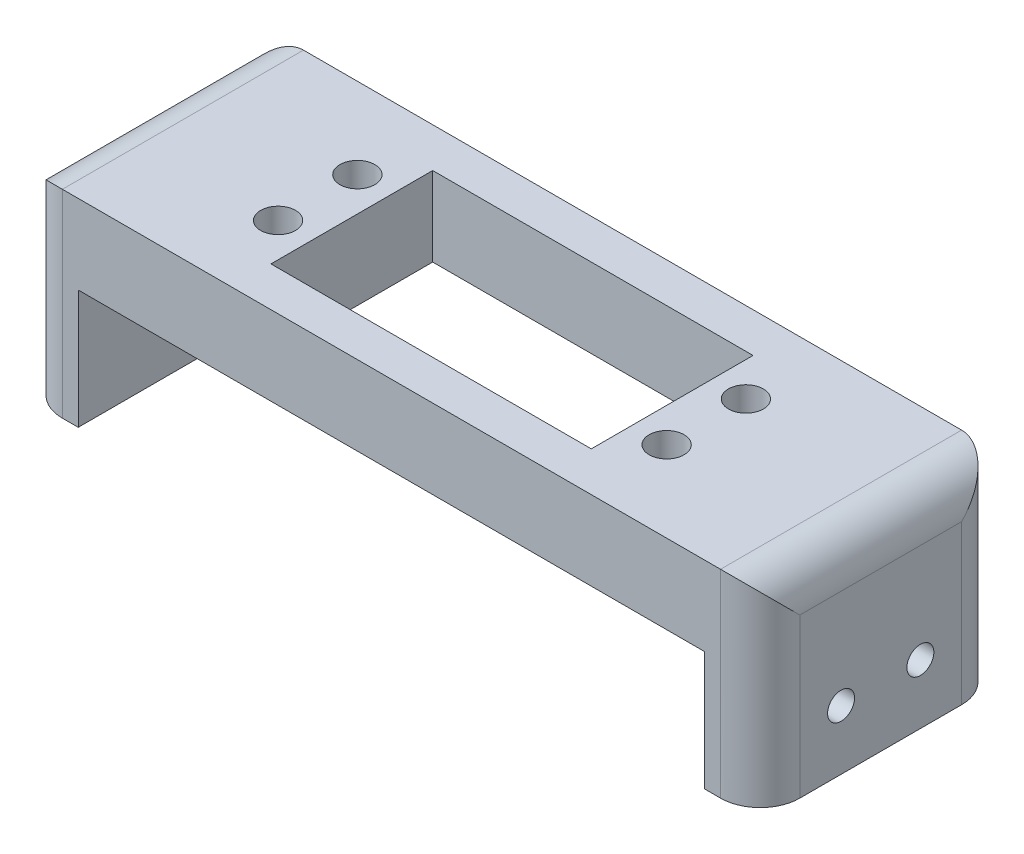
from build123d import *

# Parameters (mm, degrees)
SKETCH_1_W          = 93
SKETCH_1_H          = 30.4
SKETCH_1_R          = 2.2
SKETCH_1_W_2        = 40.4
SKETCH_1_H_2        = 20.4
EXTRUDE_1_DEPTH     = 10
SKETCH_2_W          = 7
SKETCH_2_H          = 30.4
EXTRUDE_2_DEPTH     = 15
SKETCH_4_R          = 1.7
CUT_EXTRUDE_2_DEPTH = 96.420333263
FILLET_1_R          = 5


with BuildPart() as part:
    # 草图1 → 凸台-拉伸1 (new body)
    with BuildSketch(Plane(origin=(0, 0, 0), x_dir=(1, 0, 0), z_dir=(0, 1, 0))):
        Rectangle(SKETCH_1_W, SKETCH_1_H)
        with Locations(Location((-24.5, 5, 0), (0, 0, 270))):
            Circle(SKETCH_1_R, mode=Mode.SUBTRACT)
        with Locations(Location((-24.5, -5, 0), (0, 0, 270))):
            Circle(SKETCH_1_R, mode=Mode.SUBTRACT)
        with Locations(Location((24.5, -5, 0), (0, 0, 270))):
            Circle(SKETCH_1_R, mode=Mode.SUBTRACT)
        with Locations(Location((24.5, 5, 0), (0, 0, 270))):
            Circle(SKETCH_1_R, mode=Mode.SUBTRACT)
        Rectangle(SKETCH_1_W_2, SKETCH_1_H_2, mode=Mode.SUBTRACT)
    extrude(amount=EXTRUDE_1_DEPTH)

    # 草图2 → 凸台-拉伸2 (add)
    with BuildSketch(Plane.XZ):
        with Locations((-43, 0)):
            Rectangle(SKETCH_2_W, SKETCH_2_H)
        with Locations((43, 0)):
            Rectangle(SKETCH_2_W, SKETCH_2_H)
    extrude(amount=EXTRUDE_2_DEPTH)

    # 草图4 → 切除-拉伸2 (cut, through all)
    with BuildSketch(Plane.ZY.offset(46.5)):
        with Locations((-5, -7.5)):
            Circle(SKETCH_4_R)
        with Locations((5, -7.5)):
            Circle(SKETCH_4_R)
    extrude(amount=-CUT_EXTRUDE_2_DEPTH, mode=Mode.SUBTRACT)

    # 圆角1
    fillet_1_edges = [part.edges().sort_by_distance(p)[0] for p in [
        (46.5, 10, 0),
        (-46.5, 10, 0),
        (-46.5, -2.5, -15.2),
        (46.5, -2.5, -15.2),
        (46.5, -2.5, 15.2),
        (-46.5, -2.5, 15.2),
    ]]
    fillet(fillet_1_edges, radius=FILLET_1_R)


solid = part.part
